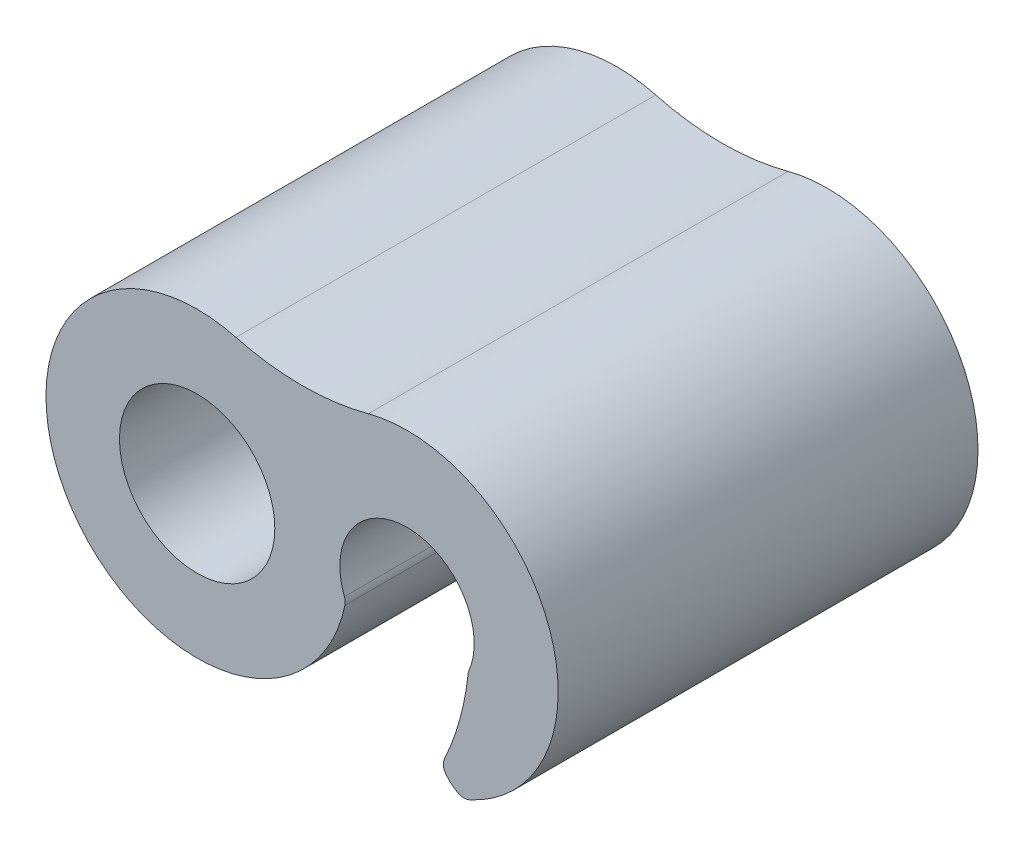
from build123d import *

# Parameters (mm, degrees)
SKETCH1_R           = 1.85
BOSS_EXTRUDE2_DEPTH = 10
FILLET2_R           = 0.3


with BuildPart() as part:
    # Sketch1 → Boss-Extrude2 (new body)
    with BuildSketch(Plane.XY):
        with BuildLine():
            ThreePointArc((1.575502084, 3.479267682), (0, 3.273519226), (-1.575502084, 3.479267682))
            ThreePointArc((-1.575502084, 3.479267682), (-5.542201702, -1.924839942), (1.04, -0.654522727))
            ThreePointArc((1.04, -0.654522727), (2.5, 1.6), (3.96, -0.654522727))
            ThreePointArc((3.96, -0.654522727), (3.740219574, -1.794341014), (3.320993506, -2.876809797))
            ThreePointArc((3.320993506, -2.876809797), (3.544154136, -3.154894829), (3.850693731, -3.337008607))
            ThreePointArc((3.850693731, -3.337008607), (5.914793747, 1.139817384), (1.575502084, 3.479267682))
        make_face()
        with Locations((-2.5, 0)):
            Circle(SKETCH1_R, mode=Mode.SUBTRACT)
    extrude(amount=BOSS_EXTRUDE2_DEPTH)

    # Fillet2
    fillet2_edges = [part.edges().sort_by_distance(p)[0] for p in [
        (1.04, -0.654522727, 5),
        (3.850693731, -3.337008607, 5),
        (3.320993506, -2.876809797, 5),
    ]]
    fillet(fillet2_edges, radius=FILLET2_R)


solid = part.part
